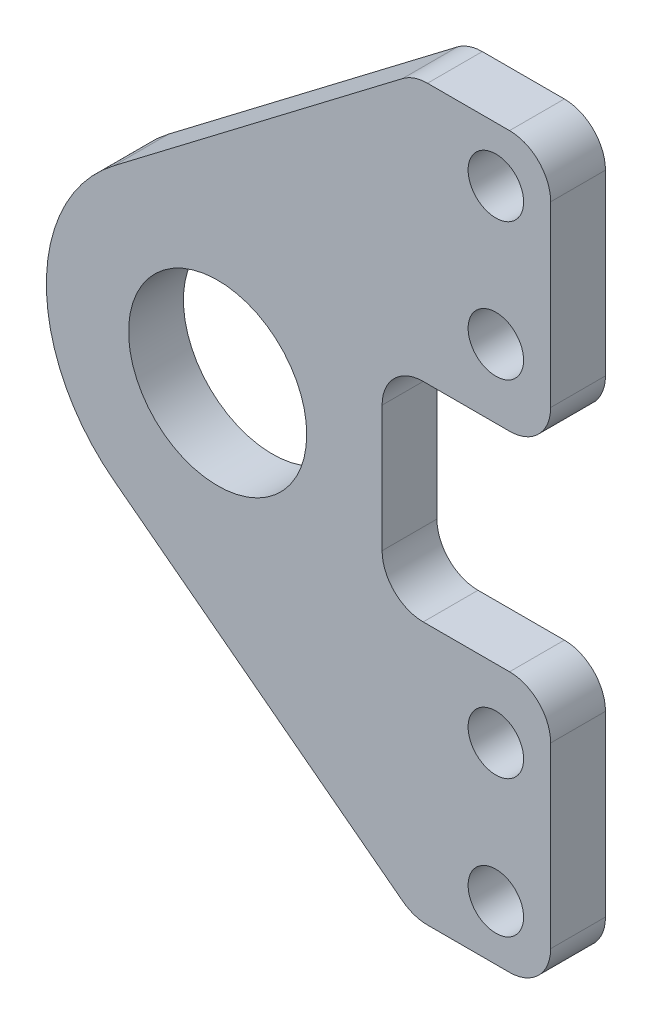
from build123d import *

# Parameters (mm, degrees)
SKETCH_1_R          = 6.5
SKETCH_1_R_2        = 2.025
EXTRUDE_1_DEPTH     = 2
SKETCH_2_W          = 12.3
SKETCH_2_H          = 15.2
CUT_EXTRUDE_1_DEPTH = 10
FILLET_1_R          = 3


with BuildPart() as part:
    # 草图1 → 凸台-拉伸1 (new, symmetric)
    with BuildSketch(Plane.XY):
        with BuildLine():
            Line((-7.572670512, 9.945082268), (14.3, 26.6))
            Line((14.3, 26.6), (24.3, 26.6))
            Line((24.3, 26.6), (24.3, -26.6))
            Line((24.3, -26.6), (14.3, -26.6))
            Line((14.3, -26.6), (-7.572670512, -9.945082268))
            ThreePointArc((-7.572670512, -9.945082268), (-12.5, 0), (-7.572670512, 9.945082268))
        make_face()
        Circle(SKETCH_1_R, mode=Mode.SUBTRACT)
        with Locations((20.3, 22.6)):
            Circle(SKETCH_1_R_2, mode=Mode.SUBTRACT)
        with Locations((20.3, 12.6)):
            Circle(SKETCH_1_R_2, mode=Mode.SUBTRACT)
        with Locations((20.3, -12.6)):
            Circle(SKETCH_1_R_2, mode=Mode.SUBTRACT)
        with Locations((20.3, -22.6)):
            Circle(SKETCH_1_R_2, mode=Mode.SUBTRACT)
    extrude(amount=EXTRUDE_1_DEPTH, both=True)

    # 草图2 → 切除-拉伸1 (cut)
    with BuildSketch(Plane.XY.offset(2)):
        with Locations((18.15, 0)):
            Rectangle(SKETCH_2_W, SKETCH_2_H)
    extrude(amount=-CUT_EXTRUDE_1_DEPTH, mode=Mode.SUBTRACT)

    # 圆角1
    fillet_1_edges = [part.edges().sort_by_distance(p)[0] for p in [
        (24.3, -26.6, 0),
        (14.3, -26.6, 0),
        (14.3, 26.6, 0),
        (24.3, 26.6, 0),
        (24.3, 7.6, 0),
        (24.3, -7.6, 0),
        (12, -7.6, 0),
        (12, 7.6, 0),
    ]]
    fillet(fillet_1_edges, radius=FILLET_1_R)


solid = part.part
